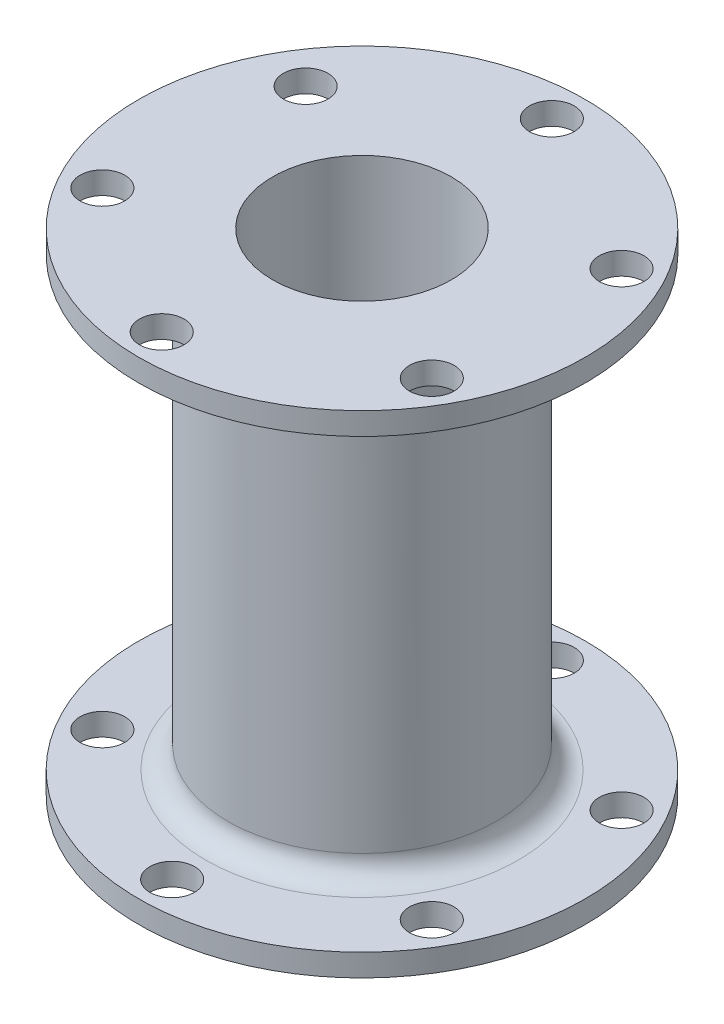
from build123d import *

# Parameters (mm, degrees)
SKETCH1_R           = 127
SKETCH1_R_2         = 50.8
BOSS_EXTRUDE1_DEPTH = 12.7
SKETCH2_R           = 12.7
CUT_EXTRUDE1_DEPTH  = 12.7
SKETCH3_R           = 76.2
BOSS_EXTRUDE2_DEPTH = 254
FILLET1_R           = 12.7
CUT_EXTRUDE2_START  = -254
SKETCH4_R           = 50.8
CUT_EXTRUDE2_DEPTH  = 254
BOSS_EXTRUDE3_START = 12.7
SKETCH5_R           = 127
BOSS_EXTRUDE3_DEPTH = 12.7
SKETCH6_R           = 50.8
CUT_EXTRUDE3_DEPTH  = 12.7
CUT_EXTRUDE4_START  = -12.7
SKETCH7_R           = 12.7
CUT_EXTRUDE4_DEPTH  = 12.7
FILLET2_R           = 12.7


with BuildPart() as part:
    # Sketch1 → Boss-Extrude1 (new body)
    with BuildSketch(Plane(origin=(0, 0, 0), x_dir=(1, 0, 0), z_dir=(0, 1, 0))):
        with Locations(Location((0, 0, 0), (0, 0, 270))):
            Circle(SKETCH1_R)
        with Locations(Location((0, 0, 0), (0, 0, 270))):
            Circle(SKETCH1_R_2, mode=Mode.SUBTRACT)
    extrude(amount=BOSS_EXTRUDE1_DEPTH)

    # Sketch2 → Cut-Extrude1 (cut)
    with BuildSketch(Plane(origin=(0, 12.7, 0), x_dir=(1, 0, 0), z_dir=(0, 1, 0))):
        with Locations(Location((0, 107.95, 0), (0, 0, 270))):
            Circle(SKETCH2_R)
        with Locations(Location((-5.932270911, -107.95, 0), (0, 0, 270))):
            Circle(SKETCH2_R)
        with Locations(Location((-86.020330735, 53.975, 0), (0, 0, 270))):
            Circle(SKETCH2_R)
        with Locations(Location((-93.6625, -53.975, 0), (0, 0, 270))):
            Circle(SKETCH2_R)
        with Locations(Location((93.6625, -53.975, 0), (0, 0, 270))):
            Circle(SKETCH2_R)
        with Locations(Location((93.6625, 53.975, 0), (0, 0, 270))):
            Circle(SKETCH2_R)
    extrude(amount=-CUT_EXTRUDE1_DEPTH, mode=Mode.SUBTRACT)

    # Sketch3 → Boss-Extrude2 (add)
    with BuildSketch(Plane.XZ):
        with Locations(Location((0, 0, 0), (0, 0, 90))):
            Circle(SKETCH3_R)
    extrude(amount=BOSS_EXTRUDE2_DEPTH)

    # Fillet1
    fillet1_edges = [part.edges().sort_by_distance(p)[0] for p in [
        (0, 0, -76.2),
    ]]
    fillet(fillet1_edges, radius=FILLET1_R)

    # Sketch4 → Cut-Extrude2 (cut)
    with BuildSketch(Plane(origin=(0, 0, 0), x_dir=(1, 0, 0), z_dir=(0, 1, 0)).offset(CUT_EXTRUDE2_START)):
        with Locations(Location((0, 0, 0), (0, 0, 270))):
            Circle(SKETCH4_R)
    extrude(amount=CUT_EXTRUDE2_DEPTH, mode=Mode.SUBTRACT)

    # Sketch5 → Boss-Extrude3 (add)
    with BuildSketch(Plane.XZ.offset(254).offset(BOSS_EXTRUDE3_START)):
        with Locations(Location((0, 0, 0), (0, 0, 90))):
            Circle(SKETCH5_R)
    extrude(amount=-BOSS_EXTRUDE3_DEPTH)

    # Sketch6 → Cut-Extrude3 (cut)
    with BuildSketch(Plane.XZ.offset(266.7)):
        with Locations(Location((0, 0, 0), (0, 0, 270))):
            Circle(SKETCH6_R)
    extrude(amount=-CUT_EXTRUDE3_DEPTH, mode=Mode.SUBTRACT)

    # Sketch7 → Cut-Extrude4 (cut)
    with BuildSketch(Plane(origin=(0, -266.7, 0), x_dir=(-1, 0, 0), z_dir=(0, -1, 0)).offset(CUT_EXTRUDE4_START)):
        with Locations(Location((0, -107.95, 0), (0, 0, 90))):
            Circle(SKETCH7_R)
        with Locations(Location((0, 107.95, 0), (0, 0, 270))):
            Circle(SKETCH7_R)
        with Locations(Location((-93.6625, 53.975, 0), (0, 0, 270))):
            Circle(SKETCH7_R)
        with Locations(Location((-93.6625, -53.975, 0), (0, 0, 270))):
            Circle(SKETCH7_R)
        with Locations(Location((93.6625, -53.975, 0), (0, 0, 270))):
            Circle(SKETCH7_R)
        with Locations(Location((93.6625, 53.975, 0), (0, 0, 90))):
            Circle(SKETCH7_R)
    extrude(amount=CUT_EXTRUDE4_DEPTH, mode=Mode.SUBTRACT)

    # Fillet2
    fillet2_edges = [part.edges().sort_by_distance(p)[0] for p in [
        (0, -254, -76.2),
    ]]
    fillet(fillet2_edges, radius=FILLET2_R)


solid = part.part
